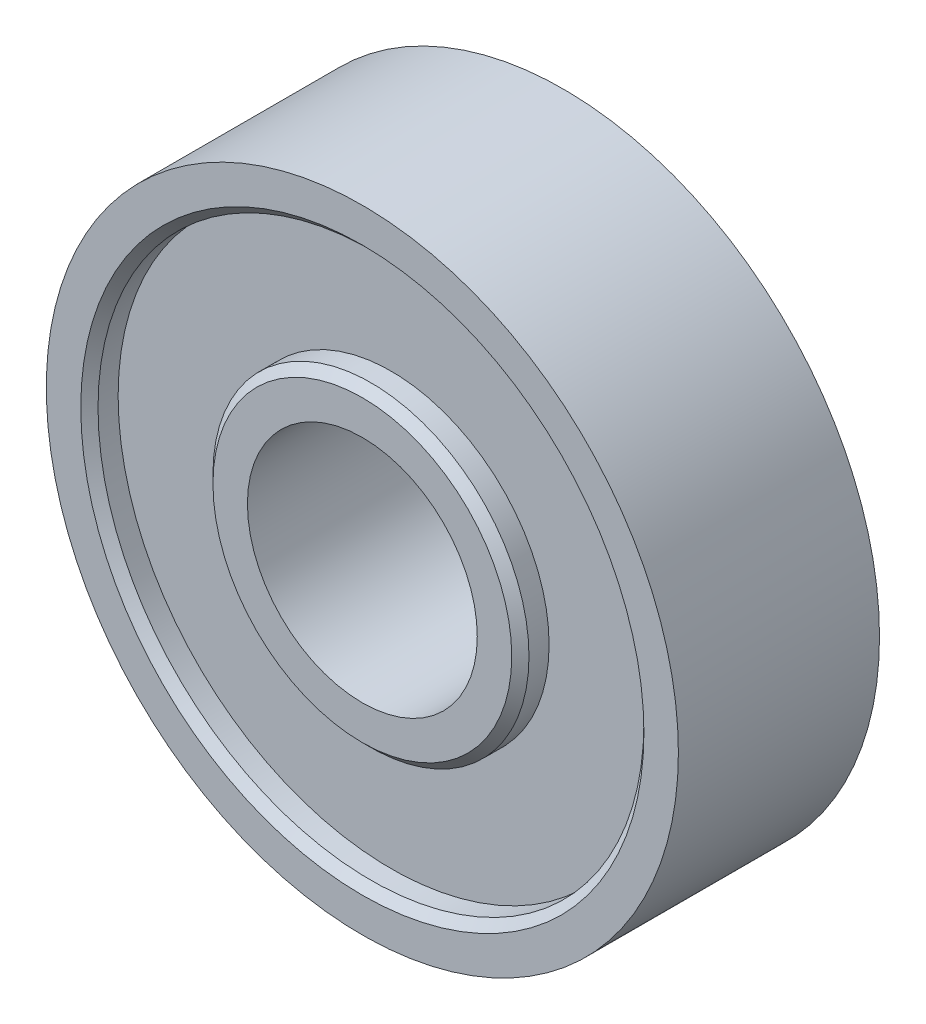
from build123d import *

# Parameters (mm, degrees)
CROQUIS1_R              = 11
CROQUIS1_R_2            = 4
SALIENTE_EXTRUIR1_DEPTH = 3.5
CROQUIS2_R              = 9.5
CROQUIS2_R_2            = 5.5
CORTAR_EXTRUIR1_DEPTH   = 1
CHAFL_N1_SIZE           = 0.3


with BuildPart() as part:
    # Croquis1 → Saliente-Extruir1 (new, symmetric)
    with BuildSketch(Plane.XY):
        Circle(CROQUIS1_R)
        Circle(CROQUIS1_R_2, mode=Mode.SUBTRACT)
    extrude(amount=SALIENTE_EXTRUIR1_DEPTH, both=True)

    # Croquis2 → Cortar-Extruir1 (cut)
    with BuildSketch(Plane.XY.offset(3.5)):
        Circle(CROQUIS2_R)
        Circle(CROQUIS2_R_2, mode=Mode.SUBTRACT)
    cortar_extruir1 = extrude(amount=-CORTAR_EXTRUIR1_DEPTH, mode=Mode.SUBTRACT)

    # Simetría1: Cortar-Extruir1 across plane
    add(cortar_extruir1.mirror(Plane.XY), mode=Mode.SUBTRACT)

    # Chaflán1
    chafl_n1_edges = [part.edges().sort_by_distance(p)[0] for p in [
        (-9.5, 0, 3.5),
        (-5.5, 0, 3.5),
        (-5.5, 0, -3.5),
        (-9.5, 0, -3.5),
    ]]
    chamfer(chafl_n1_edges, length=CHAFL_N1_SIZE)


solid = part.part
